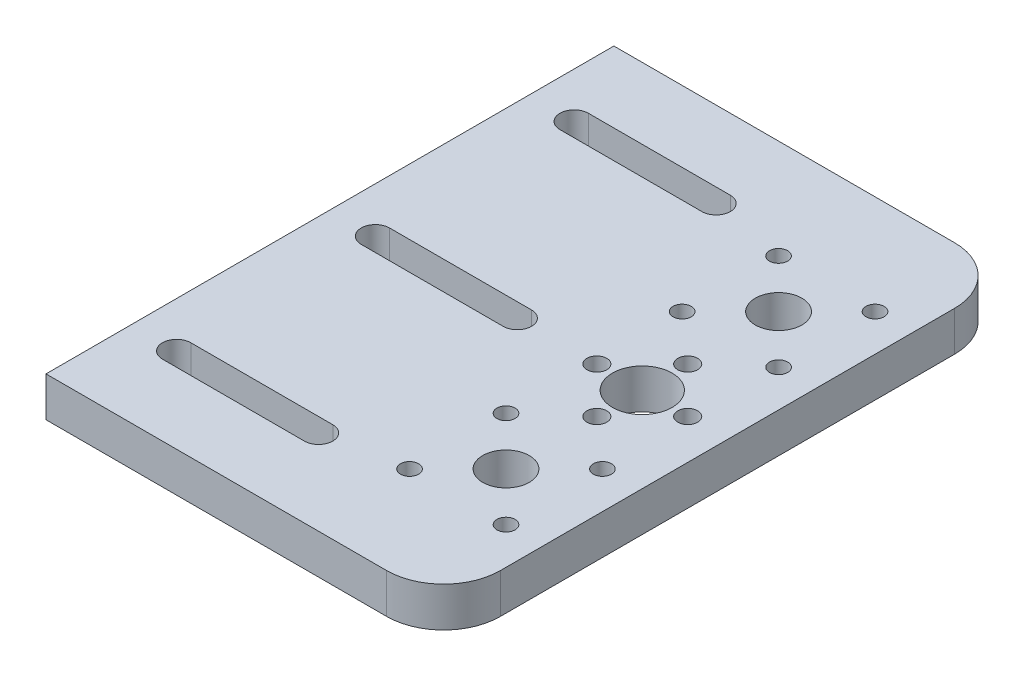
from build123d import *

# Parameters (mm, degrees)
SKETCH1_R           = 1.6
SKETCH1_R_2         = 4.1
SKETCH1_R_3         = 1.75
SKETCH1_R_4         = 5.25
BOSS_EXTRUDE1_DEPTH = 7
FILLET1_R           = 10


with BuildPart() as part:
    # Sketch1 → Boss-Extrude1 (new body)
    # profile 1 of 3: a face of its own
    with BuildSketch(Plane(origin=(0, 0, 0), x_dir=(1, 0, 0), z_dir=(0, 1, 0))):
        Polygon((0, 100), (0, 0), (56, 0), (70, 0), (70, 100), align=None)
        with BuildLine():
            Line((33, 12.5), (8, 12.5))
            ThreePointArc((8, 12.5), (5.5, 15), (8, 17.5))
            Line((8, 17.5), (33, 17.5))
            ThreePointArc((33, 17.5), (35.5, 15), (33, 12.5))
        make_face(mode=Mode.SUBTRACT)
        with Locations(Location((46.51, 17.51, 0), (0, 0, 270))):
            Circle(SKETCH1_R, mode=Mode.SUBTRACT)
        with Locations(Location((63.49, 17.51, 0), (0, 0, 270))):
            Circle(SKETCH1_R, mode=Mode.SUBTRACT)
        with Locations(Location((46.51, 34.49, 0), (0, 0, 270))):
            Circle(SKETCH1_R, mode=Mode.SUBTRACT)
        with Locations(Location((55, 26, 0), (0, 0, 270))):
            Circle(SKETCH1_R_2, mode=Mode.SUBTRACT)
        with Locations(Location((63.49, 34.49, 0), (0, 0, 270))):
            Circle(SKETCH1_R, mode=Mode.SUBTRACT)
        with Locations(Location((55, 42, 0), (0, 0, 270))):
            Circle(SKETCH1_R_3, mode=Mode.SUBTRACT)
        with BuildLine():
            ThreePointArc((8, 47.5), (5.5, 50), (8, 52.5))
            Line((8, 52.5), (33, 52.5))
            ThreePointArc((33, 52.5), (35.5, 50), (33, 47.5))
            Line((33, 47.5), (8, 47.5))
        make_face(mode=Mode.SUBTRACT)
        with BuildLine():
            ThreePointArc((8, 82.5), (5.5, 85), (8, 87.5))
            Line((8, 87.5), (33, 87.5))
            ThreePointArc((33, 87.5), (35.5, 85), (33, 82.5))
            Line((33, 82.5), (8, 82.5))
        make_face(mode=Mode.SUBTRACT)
        with Locations(Location((47, 50, 0), (0, 0, 270))):
            Circle(SKETCH1_R_3, mode=Mode.SUBTRACT)
        with Locations(Location((46.51, 65.51, 0), (0, 0, 270))):
            Circle(SKETCH1_R, mode=Mode.SUBTRACT)
        with Locations(Location((55, 50, 0), (0, 0, 270))):
            Circle(SKETCH1_R_4, mode=Mode.SUBTRACT)
        with Locations(Location((55, 58, 0), (0, 0, 270))):
            Circle(SKETCH1_R_3, mode=Mode.SUBTRACT)
        with Locations(Location((63, 50, 0), (0, 0, 270))):
            Circle(SKETCH1_R_3, mode=Mode.SUBTRACT)
        with Locations(Location((55, 74, 0), (0, 0, 270))):
            Circle(SKETCH1_R_2, mode=Mode.SUBTRACT)
        with Locations(Location((63.49, 65.51, 0), (0, 0, 270))):
            Circle(SKETCH1_R, mode=Mode.SUBTRACT)
        with Locations(Location((46.51, 82.49, 0), (0, 0, 270))):
            Circle(SKETCH1_R, mode=Mode.SUBTRACT)
        with Locations(Location((63.49, 82.49, 0), (0, 0, 270))):
            Circle(SKETCH1_R, mode=Mode.SUBTRACT)
    # profile 2 of 3: a face of its own
    with BuildSketch(Plane(origin=(0, 0, 0), x_dir=(1, 0, 0), z_dir=(0, 1, 0))):
        Polygon((0, 100), (0, 0), (56, 0), (70, 0), (70, 100), align=None)
        with BuildLine():
            Line((33, 12.5), (8, 12.5))
            ThreePointArc((8, 12.5), (5.5, 15), (8, 17.5))
            Line((8, 17.5), (33, 17.5))
            ThreePointArc((33, 17.5), (35.5, 15), (33, 12.5))
        make_face(mode=Mode.SUBTRACT)
        with Locations(Location((46.51, 17.51, 0), (0, 0, 270))):
            Circle(SKETCH1_R, mode=Mode.SUBTRACT)
        with Locations(Location((63.49, 17.51, 0), (0, 0, 270))):
            Circle(SKETCH1_R, mode=Mode.SUBTRACT)
        with Locations(Location((46.51, 34.49, 0), (0, 0, 270))):
            Circle(SKETCH1_R, mode=Mode.SUBTRACT)
        with Locations(Location((55, 26, 0), (0, 0, 270))):
            Circle(SKETCH1_R_2, mode=Mode.SUBTRACT)
        with Locations(Location((63.49, 34.49, 0), (0, 0, 270))):
            Circle(SKETCH1_R, mode=Mode.SUBTRACT)
        with Locations(Location((55, 42, 0), (0, 0, 270))):
            Circle(SKETCH1_R_3, mode=Mode.SUBTRACT)
        with BuildLine():
            ThreePointArc((8, 47.5), (5.5, 50), (8, 52.5))
            Line((8, 52.5), (33, 52.5))
            ThreePointArc((33, 52.5), (35.5, 50), (33, 47.5))
            Line((33, 47.5), (8, 47.5))
        make_face(mode=Mode.SUBTRACT)
        with BuildLine():
            ThreePointArc((8, 82.5), (5.5, 85), (8, 87.5))
            Line((8, 87.5), (33, 87.5))
            ThreePointArc((33, 87.5), (35.5, 85), (33, 82.5))
            Line((33, 82.5), (8, 82.5))
        make_face(mode=Mode.SUBTRACT)
        with Locations(Location((47, 50, 0), (0, 0, 270))):
            Circle(SKETCH1_R_3, mode=Mode.SUBTRACT)
        with Locations(Location((46.51, 65.51, 0), (0, 0, 270))):
            Circle(SKETCH1_R, mode=Mode.SUBTRACT)
        with Locations(Location((55, 50, 0), (0, 0, 270))):
            Circle(SKETCH1_R_4, mode=Mode.SUBTRACT)
        with Locations(Location((55, 58, 0), (0, 0, 270))):
            Circle(SKETCH1_R_3, mode=Mode.SUBTRACT)
        with Locations(Location((63, 50, 0), (0, 0, 270))):
            Circle(SKETCH1_R_3, mode=Mode.SUBTRACT)
        with Locations(Location((55, 74, 0), (0, 0, 270))):
            Circle(SKETCH1_R_2, mode=Mode.SUBTRACT)
        with Locations(Location((63.49, 65.51, 0), (0, 0, 270))):
            Circle(SKETCH1_R, mode=Mode.SUBTRACT)
        with Locations(Location((46.51, 82.49, 0), (0, 0, 270))):
            Circle(SKETCH1_R, mode=Mode.SUBTRACT)
        with Locations(Location((63.49, 82.49, 0), (0, 0, 270))):
            Circle(SKETCH1_R, mode=Mode.SUBTRACT)
    # profile 3 of 3: a face of its own
    with BuildSketch(Plane(origin=(0, 0, 0), x_dir=(1, 0, 0), z_dir=(0, 1, 0))):
        Polygon((0, 100), (0, 0), (56, 0), (70, 0), (70, 100), align=None)
        with BuildLine():
            Line((33, 12.5), (8, 12.5))
            ThreePointArc((8, 12.5), (5.5, 15), (8, 17.5))
            Line((8, 17.5), (33, 17.5))
            ThreePointArc((33, 17.5), (35.5, 15), (33, 12.5))
        make_face(mode=Mode.SUBTRACT)
        with Locations(Location((46.51, 17.51, 0), (0, 0, 270))):
            Circle(SKETCH1_R, mode=Mode.SUBTRACT)
        with Locations(Location((63.49, 17.51, 0), (0, 0, 270))):
            Circle(SKETCH1_R, mode=Mode.SUBTRACT)
        with Locations(Location((46.51, 34.49, 0), (0, 0, 270))):
            Circle(SKETCH1_R, mode=Mode.SUBTRACT)
        with Locations(Location((55, 26, 0), (0, 0, 270))):
            Circle(SKETCH1_R_2, mode=Mode.SUBTRACT)
        with Locations(Location((63.49, 34.49, 0), (0, 0, 270))):
            Circle(SKETCH1_R, mode=Mode.SUBTRACT)
        with Locations(Location((55, 42, 0), (0, 0, 270))):
            Circle(SKETCH1_R_3, mode=Mode.SUBTRACT)
        with BuildLine():
            ThreePointArc((8, 47.5), (5.5, 50), (8, 52.5))
            Line((8, 52.5), (33, 52.5))
            ThreePointArc((33, 52.5), (35.5, 50), (33, 47.5))
            Line((33, 47.5), (8, 47.5))
        make_face(mode=Mode.SUBTRACT)
        with BuildLine():
            ThreePointArc((8, 82.5), (5.5, 85), (8, 87.5))
            Line((8, 87.5), (33, 87.5))
            ThreePointArc((33, 87.5), (35.5, 85), (33, 82.5))
            Line((33, 82.5), (8, 82.5))
        make_face(mode=Mode.SUBTRACT)
        with Locations(Location((47, 50, 0), (0, 0, 270))):
            Circle(SKETCH1_R_3, mode=Mode.SUBTRACT)
        with Locations(Location((46.51, 65.51, 0), (0, 0, 270))):
            Circle(SKETCH1_R, mode=Mode.SUBTRACT)
        with Locations(Location((55, 50, 0), (0, 0, 270))):
            Circle(SKETCH1_R_4, mode=Mode.SUBTRACT)
        with Locations(Location((55, 58, 0), (0, 0, 270))):
            Circle(SKETCH1_R_3, mode=Mode.SUBTRACT)
        with Locations(Location((63, 50, 0), (0, 0, 270))):
            Circle(SKETCH1_R_3, mode=Mode.SUBTRACT)
        with Locations(Location((55, 74, 0), (0, 0, 270))):
            Circle(SKETCH1_R_2, mode=Mode.SUBTRACT)
        with Locations(Location((63.49, 65.51, 0), (0, 0, 270))):
            Circle(SKETCH1_R, mode=Mode.SUBTRACT)
        with Locations(Location((46.51, 82.49, 0), (0, 0, 270))):
            Circle(SKETCH1_R, mode=Mode.SUBTRACT)
        with Locations(Location((63.49, 82.49, 0), (0, 0, 270))):
            Circle(SKETCH1_R, mode=Mode.SUBTRACT)
    extrude(amount=BOSS_EXTRUDE1_DEPTH)

    # Fillet1
    fillet1_edges = [part.edges().sort_by_distance(p)[0] for p in [
        (70, 3.5, -100),
        (70, 3.5, 0),
    ]]
    fillet(fillet1_edges, radius=FILLET1_R)


solid = part.part
